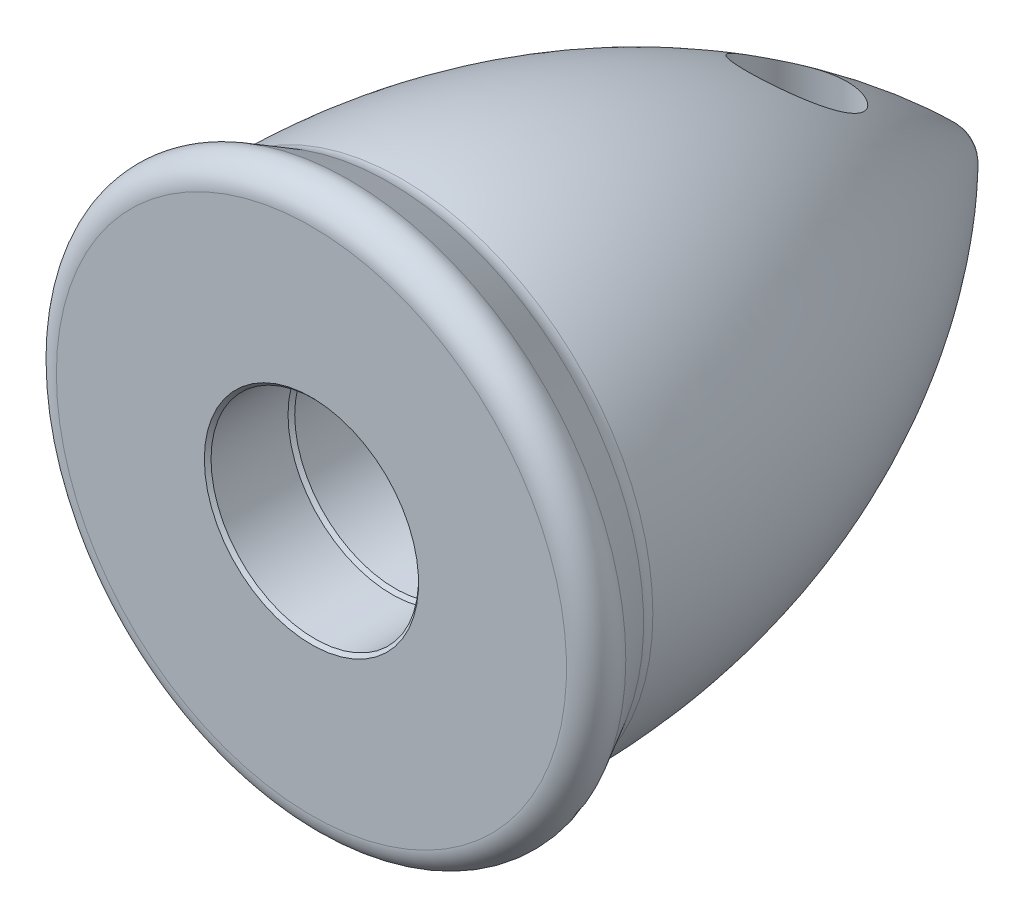
from build123d import *

# Parameters (mm, degrees)
KES_EKSTR_ZYON1_DEPTH      = 10
KES_EKSTR_ZYON1_DEPTH_BACK = 10
IZIM3_R                    = 1.500000006


with BuildPart() as part:
    # Çizim2 → Döndür1 (revolve)
    with BuildSketch(Plane(origin=(0, 0, 0), x_dir=(1, 0, 0), z_dir=(0, 1, 0))):
        with BuildLine():
            ThreePointArc((0.714321501, 18.797107068), (0.387416, 19.01919439), (0, 19.097289382))
            Line((0, 19.097289382), (0, 16.751989926))
            Line((0, 16.751989926), (2, 15.597289388))
            Line((2, 15.597289388), (2, 12.59728938))
            Line((2, 12.59728938), (2, 12.34728938))
            ThreePointArc((2, 12.34728938), (2.292893219, 11.640182599), (3, 11.34728938))
            Line((3, 11.34728938), (3, 2.097289382))
            Line((3, 2.097289382), (3.1, 1.997289382))
            Line((3.1, 1.997289382), (3.1, -0.302710618))
            Line((3.1, -0.302710618), (3.2, -0.402710618))
            Line((3.2, -0.402710618), (7.620407073, -0.402710618))
            ThreePointArc((7.620407073, -0.402710618), (8.267453978, -0.031960275), (8.274786585, 0.713741909))
            Line((8.274786585, 0.713741909), (7.597990851, 1.92230572))
            ThreePointArc((7.597990851, 1.92230572), (7.525925262, 2.102270942), (7.502393864, 2.294695482))
            add(Edge.make_bspline(
                [(7.502393864, 2.294695482), (7.529730545, 5.747795495), (6.183392383, 11.759486708), (2.676539792, 16.794221541), (0.714321501, 18.797107068)],
                knots=[0.009809258, 0.009809258, 0.009809258, 0.009809258, 0.525019897, 0.949749031, 0.949749031, 0.949749031, 0.949749031], degree=3))
        make_face()
    revolve(axis=Axis((0, 0, -16.751989926), (0, 0, 1)))

    # Çizim3 → Kes-Ekstrüzyon1 (cut, two sides: drawn at the far end of the back side and taken through both)
    with BuildSketch(Plane(origin=(0, 0, 0), x_dir=(1, 0, 0), z_dir=(0, 1, 0)).offset(-KES_EKSTR_ZYON1_DEPTH_BACK)):
        with Locations((0, 14.097289382)):
            Circle(IZIM3_R)
    extrude(amount=KES_EKSTR_ZYON1_DEPTH + KES_EKSTR_ZYON1_DEPTH_BACK, mode=Mode.SUBTRACT)


solid = part.part
